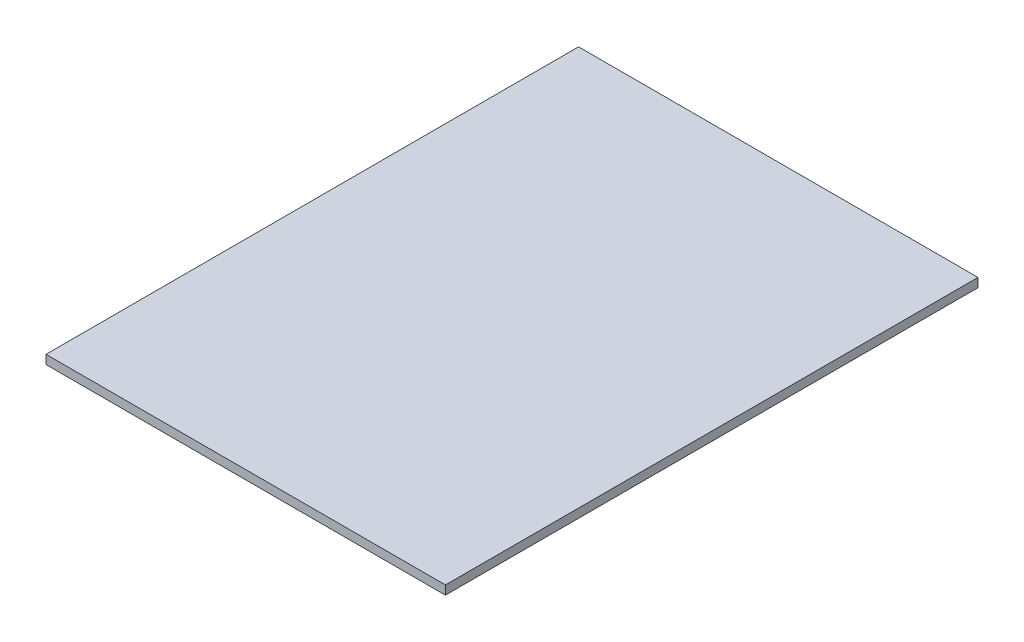
from build123d import *

# Parameters (mm, degrees)
ESBO_O1_W                = 270
ESBO_O1_H                = 360
RESSALTO_EXTRUS_O1_DEPTH = 6


with BuildPart() as part:
    # Esboço1 → Ressalto-extrusão1 (new body)
    with BuildSketch(Plane(origin=(0, 0, 0), x_dir=(1, 0, 0), z_dir=(0, 1, 0))):
        with Locations((-135, 180)):
            Rectangle(ESBO_O1_W, ESBO_O1_H)
    extrude(amount=RESSALTO_EXTRUS_O1_DEPTH)


solid = part.part
